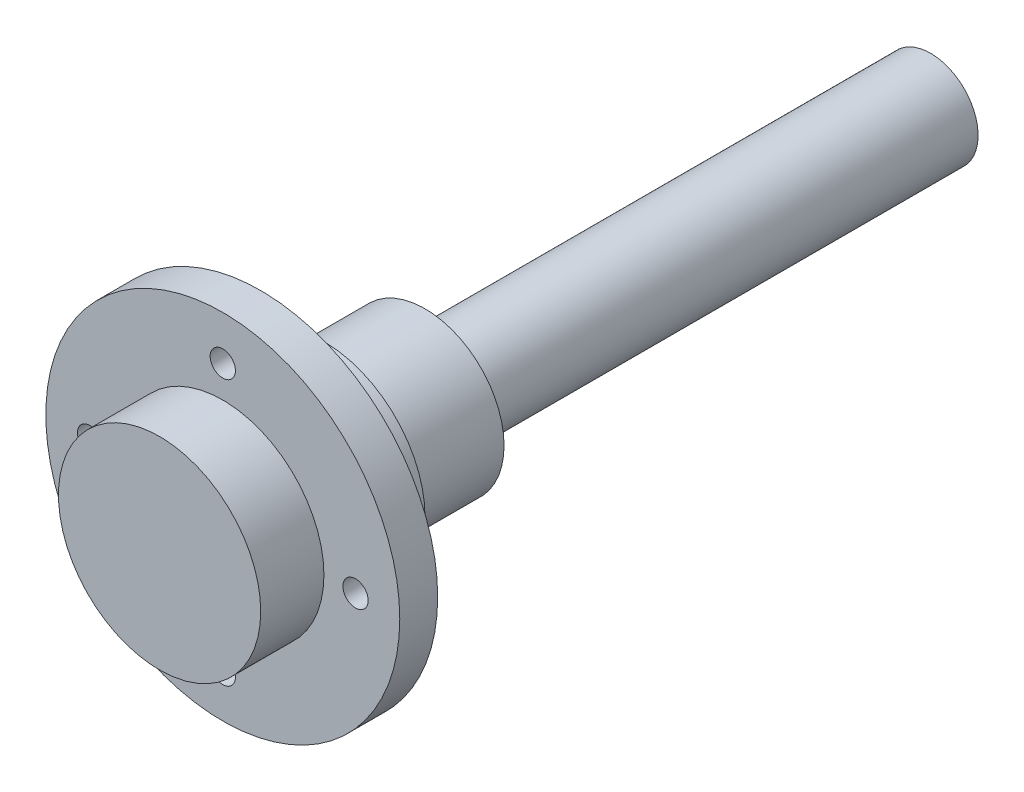
from build123d import *

# Parameters (mm, degrees)
SKETCH_1_R               = 12.5
EXTRUDE_1_DEPTH          = 16
SKETCH_2_R               = 16
EXTRUDE_2_DEPTH          = 10
SKETCH_3_R               = 28
EXTRUDE_3_DEPTH          = 6
SKETCH_6_R               = 2
CUT_EXTRUDE_1_DEPTH      = 10
PATTERN_CIRCULAR_2_COUNT = 4
SKETCH_8_R               = 16
EXTRUDE_5_DEPTH          = 10
SKETCH_7_R               = 7.5
EXTRUDE_6_DEPTH          = 80


with BuildPart() as part:
    # 草图1 → 凸台-拉伸1 (new body)
    with BuildSketch(Plane.XY):
        Circle(SKETCH_1_R)
    extrude(amount=EXTRUDE_1_DEPTH)

    # 草图2 → 凸台-拉伸2 (add)
    with BuildSketch(Plane.XY.offset(16)):
        Circle(SKETCH_2_R)
    extrude(amount=EXTRUDE_2_DEPTH)

    # 草图3 → 凸台-拉伸3 (add)
    with BuildSketch(Plane.XY.offset(26)):
        Circle(SKETCH_3_R)
    extrude(amount=EXTRUDE_3_DEPTH)

    # 草图6 → 切除-拉伸1 (cut)
    with BuildSketch(Plane(origin=(0, 0, 26), x_dir=(-1, 0, 0), z_dir=(0, 0, -1))):
        with Locations((0, 21)):
            Circle(SKETCH_6_R)
    cut_extrude_1 = extrude(amount=-CUT_EXTRUDE_1_DEPTH, mode=Mode.SUBTRACT)

    # 阵列(圆周)2: 切除-拉伸1 ×4 about axis
    pattern_circular_2_axis = Axis((0, 0, 0), (0, 0, 1))
    for i in range(1, PATTERN_CIRCULAR_2_COUNT):
        add(cut_extrude_1.rotate(pattern_circular_2_axis, i * 360 / PATTERN_CIRCULAR_2_COUNT), mode=Mode.SUBTRACT)

    # 草图8 → 凸台-拉伸5 (add)
    with BuildSketch(Plane.XY.offset(32)):
        Circle(SKETCH_8_R)
    extrude(amount=EXTRUDE_5_DEPTH)

    # 草图7 → 凸台-拉伸6 (add)
    with BuildSketch(Plane(origin=(0, 0, 0), x_dir=(-1, 0, 0), z_dir=(0, 0, -1))):
        Circle(SKETCH_7_R)
    extrude(amount=EXTRUDE_6_DEPTH)


solid = part.part
